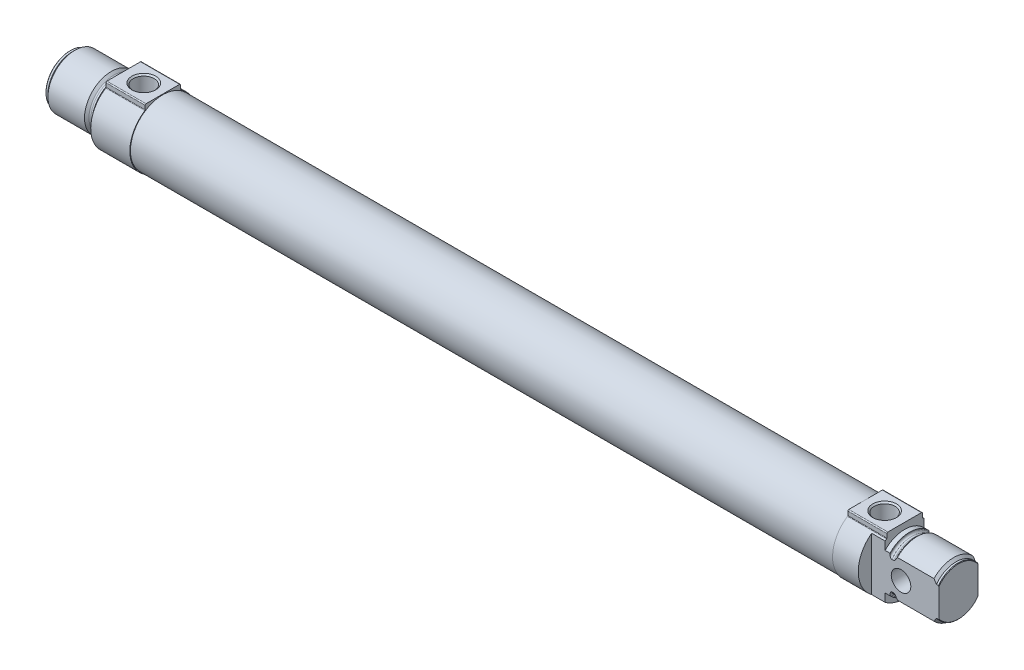
from build123d import *

# Parameters (mm, degrees)
AUFSATZ_LINEAR_AUSTRAGEN1_DEPTH      = 16
SKIZZE3_W                            = 287.5
SKIZZE3_H                            = 13.25
AUFSATZ_LINEAR_AUSTRAGEN2_DEPTH      = 16
SCHNITT_LINEAR_AUSTRAGEN1_DEPTH      = 13.5
SCHNITT_LINEAR_AUSTRAGEN1_DEPTH_BACK = 13.5
BOHRUNG1_D                           = 8
BOHRUNG2_D                           = 8.566
BOHRUNG2_DEPTH                       = 13.5
BOHRUNG2_CSINK_D                     = 9.728
BOHRUNG2_CSINK_ANGLE                 = 90
BOHRUNG3_D                           = 8.566
BOHRUNG3_DEPTH                       = 16
BOHRUNG3_CSINK_D                     = 9.728
BOHRUNG3_CSINK_ANGLE                 = 90
BOHRUNG3_TIP                         = 2.472791203


with BuildPart() as part:
    # Skizze1 → Rotation1 (revolve)
    with BuildSketch(Plane.XY):
        with BuildLine():
            Line((0, 0), (0, 9.8))
            Line((0, 9.8), (0.2, 10))
            Line((0.2, 10), (1, 10))
            Line((1, 10), (2, 11))
            Line((2, 11), (16.95, 11))
            Line((16.95, 11), (17.865685425, 10.084314575))
            ThreePointArc((17.865685425, 10.084314575), (18.125224104, 9.910896374), (18.43137085, 9.85))
            Line((18.43137085, 9.85), (19.2, 9.85))
            ThreePointArc((19.2, 9.85), (19.765685425, 10.084314575), (20, 10.65))
            Line((20, 10.65), (20, 11))
            Line((20, 11), (22, 11))
            Line((22, 11), (22, 0))
            Line((22, 0), (0, 0))
        make_face()
    revolve(axis=Axis((22, 0, 0), (-1, 0, 0)))

    # Skizze2 → Aufsatz-Linear austragen1 (add)
    with BuildSketch(Plane(origin=(22, 0, 0), x_dir=(0, 0, -1), z_dir=(1, 0, 0))):
        with BuildLine():
            Line((7.25, 11.551515052), (7.25, 13.1))
            ThreePointArc((7.25, 13.1), (7.132842712, 13.382842712), (6.85, 13.5))
            Line((6.85, 13.5), (-6.85, 13.5))
            ThreePointArc((-6.85, 13.5), (-7.132842712, 13.382842712), (-7.25, 13.1))
            Line((-7.25, 13.1), (-7.25, 11.551515052))
            ThreePointArc((-7.25, 11.551515052), (-7.286144803, 11.408754992), (-7.385869565, 11.30039516))
            ThreePointArc((-7.385869565, 11.30039516), (0, -13.5), (7.385869565, 11.30039516))
            ThreePointArc((7.385869565, 11.30039516), (7.286144803, 11.408754992), (7.25, 11.551515052))
        make_face()
    extrude(amount=AUFSATZ_LINEAR_AUSTRAGEN1_DEPTH)

    # Skizze3 → Rotation2 (revolve)
    with BuildSketch(Plane.XY):
        with Locations((181.75, 6.625)):
            Rectangle(SKIZZE3_W, SKIZZE3_H)
    revolve(axis=Axis((325.5, 0, 0), (-1, 0, 0)))

    # Skizze4 → Aufsatz-Linear austragen2 (add)
    with BuildSketch(Plane(origin=(325.5, 0, 0), x_dir=(0, 0, -1), z_dir=(1, 0, 0))):
        with BuildLine():
            Line((7.25, 11.551515052), (7.25, 13.1))
            ThreePointArc((7.25, 13.1), (7.132842712, 13.382842712), (6.85, 13.5))
            Line((6.85, 13.5), (-6.85, 13.5))
            ThreePointArc((-6.85, 13.5), (-7.132842712, 13.382842712), (-7.25, 13.1))
            Line((-7.25, 13.1), (-7.25, 11.551515052))
            ThreePointArc((-7.25, 11.551515052), (-7.286144803, 11.408754992), (-7.385869565, 11.30039516))
            ThreePointArc((-7.385869565, 11.30039516), (0, -13.5), (7.385869565, 11.30039516))
            ThreePointArc((7.385869565, 11.30039516), (7.286144803, 11.408754992), (7.25, 11.551515052))
        make_face()
    extrude(amount=AUFSATZ_LINEAR_AUSTRAGEN2_DEPTH)

    # Skizze5 → Rotation3 (revolve)
    with BuildSketch(Plane.XY):
        with BuildLine():
            Line((341.5, 0), (341.5, 11))
            Line((341.5, 11), (343.5, 11))
            Line((343.5, 11), (343.5, 10.65))
            ThreePointArc((343.5, 10.65), (343.734314575, 10.084314575), (344.3, 9.85))
            Line((344.3, 9.85), (345.06862915, 9.85))
            ThreePointArc((345.06862915, 9.85), (345.374775896, 9.910896374), (345.634314575, 10.084314575))
            Line((345.634314575, 10.084314575), (346.55, 11))
            Line((346.55, 11), (361.5, 11))
            Line((361.5, 11), (362.5, 10))
            Line((362.5, 10), (363.3, 10))
            Line((363.3, 10), (363.5, 9.8))
            Line((363.5, 9.8), (363.5, 0))
            Line((363.5, 0), (341.5, 0))
        make_face()
    revolve(axis=Axis((363.5, 0, 0), (-1, 0, 0)))

    # Skizze6 → Schnitt-Linear austragen1 (cut, two sides: drawn at the far end of the back side and taken through both)
    with BuildSketch(Plane(origin=(0, 0, 0), x_dir=(1, 0, 0), z_dir=(0, 1, 0)).offset(-SCHNITT_LINEAR_AUSTRAGEN1_DEPTH_BACK)):
        Polygon((336, 24), (336, 8), (363.5, 8), (363.5, -8), (336, -8), (336, -24), (379.5, -24), (379.5, 24), align=None)
    extrude(amount=SCHNITT_LINEAR_AUSTRAGEN1_DEPTH + SCHNITT_LINEAR_AUSTRAGEN1_DEPTH_BACK, mode=Mode.SUBTRACT)

    # Bohrung1 (through all)
    with Locations(Plane(origin=(0, 0, -8), x_dir=(-1, 0, 0), z_dir=(0, 0, -1))):
        with Locations((-348, 0)):
            Hole(BOHRUNG1_D / 2)

    # Bohrung2
    with Locations(Plane(origin=(0, 13.5, 0), x_dir=(1, 0, 0), z_dir=(0, 1, 0))):
        with Locations((30.2, 0)):
            CounterSinkHole(BOHRUNG2_D / 2, BOHRUNG2_CSINK_D / 2, depth=BOHRUNG2_DEPTH, counter_sink_angle=BOHRUNG2_CSINK_ANGLE)

    # Bohrung3
    with Locations(Plane(origin=(0, 13.5, 0), x_dir=(1, 0, 0), z_dir=(0, 1, 0))):
        with Locations((333.3, 0)):
            CounterSinkHole(BOHRUNG3_D / 2, BOHRUNG3_CSINK_D / 2, depth=BOHRUNG3_DEPTH, counter_sink_angle=BOHRUNG3_CSINK_ANGLE)
            with Locations((0, 0, -(BOHRUNG3_DEPTH + BOHRUNG3_TIP / 2))):  # 120° drill point
                Cone(0, BOHRUNG3_D / 2, BOHRUNG3_TIP, mode=Mode.SUBTRACT)

    # Skizze13 → Schnitt-Rotation1 (revolve, cut)
    with BuildSketch(Plane.XY):
        Polygon((-6, 0), (-6, 5), (52.6, 5), (52.6, 12.5), (308.85, 12.5), (308.85, 0), align=None)
    revolve(axis=Axis((308.85, 0, 0), (-1, 0, 0)), mode=Mode.SUBTRACT)


solid = part.part
